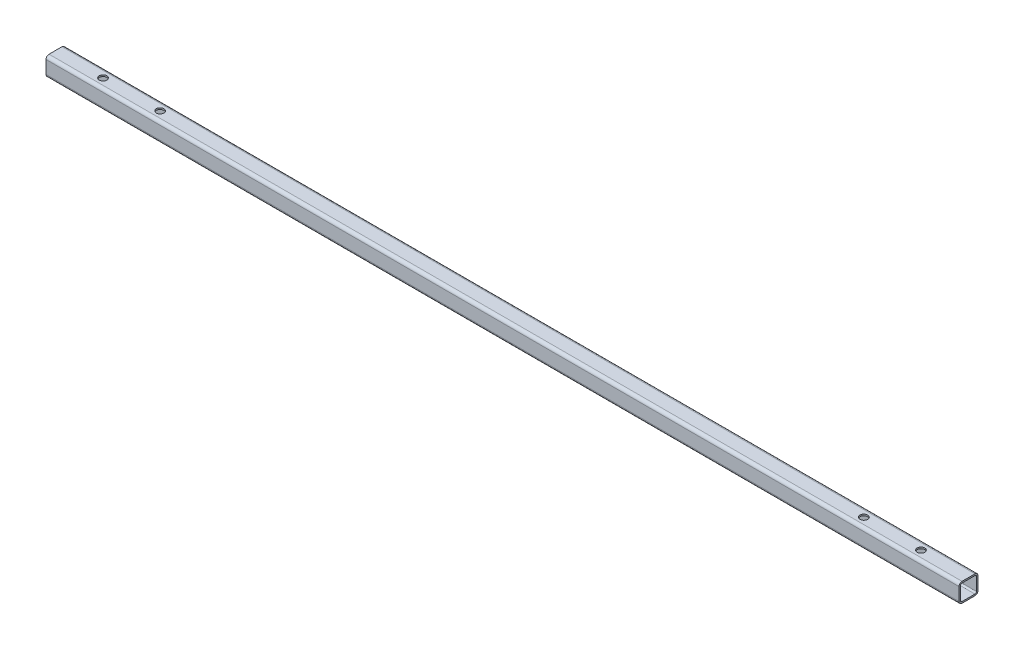
from build123d import *

# Parameters (mm, degrees)
TUBE_SQUARE_40_X_40_X_3_2_3_DEPTH = 1920
SKETCH13_R                        = 8
CUT_EXTRUDE1_DEPTH                = 1921.52076271


with BuildPart() as part:
    # Sketch12 → Tube (square) 40 X 40 X 3.2(3) (new body)
    with BuildSketch(Plane(origin=(0, 0, 0), x_dir=(0, 0, -1), z_dir=(1, 0, 0))):
        with BuildLine():
            Line((-13.6, -20), (13.6, -20))
            ThreePointArc((13.6, -20), (18.1254834, -18.1254834), (20, -13.6))
            Line((20, -13.6), (20, 13.6))
            ThreePointArc((20, 13.6), (18.1254834, 18.1254834), (13.6, 20))
            Line((13.6, 20), (-13.6, 20))
            ThreePointArc((-13.6, 20), (-18.1254834, 18.1254834), (-20, 13.6))
            Line((-20, 13.6), (-20, -13.6))
            ThreePointArc((-20, -13.6), (-18.1254834, -18.1254834), (-13.6, -20))
        make_face()
        with BuildLine():
            Line((-13.6, -16.8), (13.6, -16.8))
            ThreePointArc((13.6, -16.8), (15.8627417, -15.8627417), (16.8, -13.6))
            Line((16.8, -13.6), (16.8, 13.6))
            ThreePointArc((16.8, 13.6), (15.8627417, 15.8627417), (13.6, 16.8))
            Line((13.6, 16.8), (-13.6, 16.8))
            ThreePointArc((-13.6, 16.8), (-15.8627417, 15.8627417), (-16.8, 13.6))
            Line((-16.8, 13.6), (-16.8, -13.6))
            ThreePointArc((-16.8, -13.6), (-15.8627417, -15.8627417), (-13.6, -16.8))
        make_face(mode=Mode.SUBTRACT)
    extrude(amount=TUBE_SQUARE_40_X_40_X_3_2_3_DEPTH)

    # Sketch13 → Cut-Extrude1 (cut, through all)
    with BuildSketch(Plane(origin=(0, 20, 0), x_dir=(1, 0, 0), z_dir=(0, 1, 0))):
        with Locations(Location((220, 0, 0), (0, 0, 270))):
            Circle(SKETCH13_R)
        with Locations(Location((1700, 0, 0), (0, 0, 270))):
            Circle(SKETCH13_R)
        with Locations(Location((100, 0, 0), (0, 0, 270))):
            Circle(SKETCH13_R)
        with Locations(Location((1820, 0, 0), (0, 0, 270))):
            Circle(SKETCH13_R)
    extrude(amount=-CUT_EXTRUDE1_DEPTH, mode=Mode.SUBTRACT)


solid = part.part
